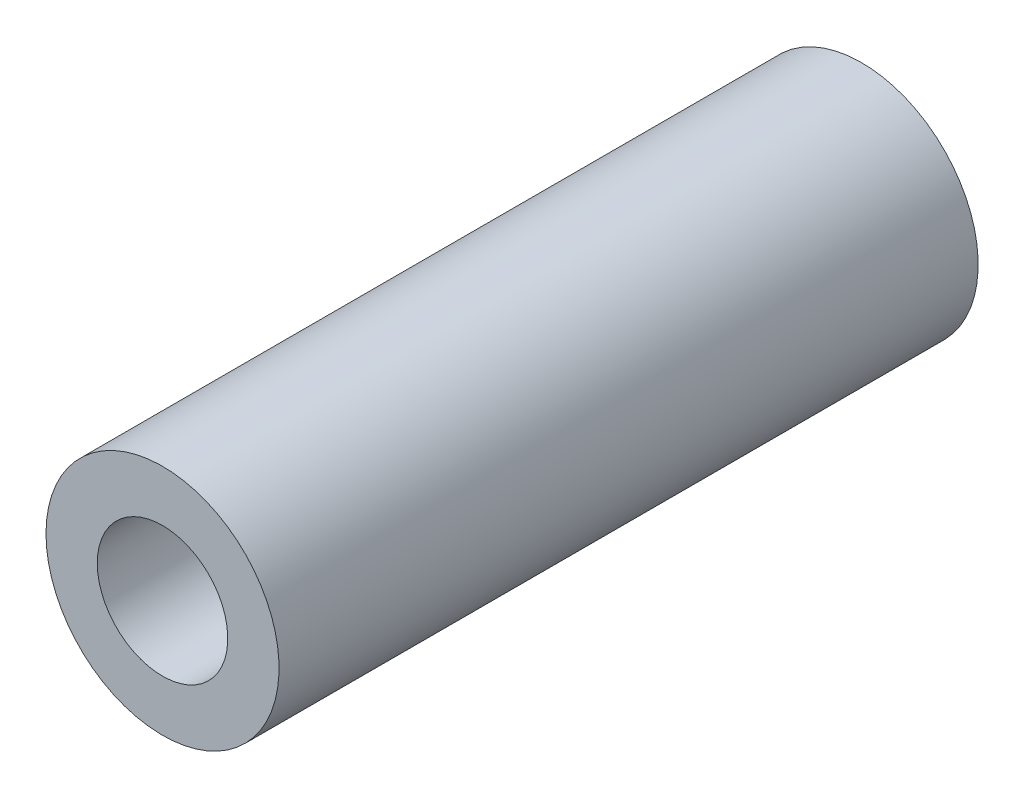
from build123d import *

# Parameters (mm, degrees)
SKETCH1_R      = 3.175
SKETCH1_R_2    = 1.778
EXTRUDE1_DEPTH = 9.525


with BuildPart() as part:
    # Sketch1 → Extrude1 (new, symmetric)
    with BuildSketch(Plane.XY):
        with Locations(Location((0, 0, 0), (0, 0, 180))):
            Circle(SKETCH1_R)
        with Locations(Location((0, 0, 0), (0, 0, 180))):
            Circle(SKETCH1_R_2, mode=Mode.SUBTRACT)
    extrude(amount=EXTRUDE1_DEPTH, both=True)


solid = part.part
